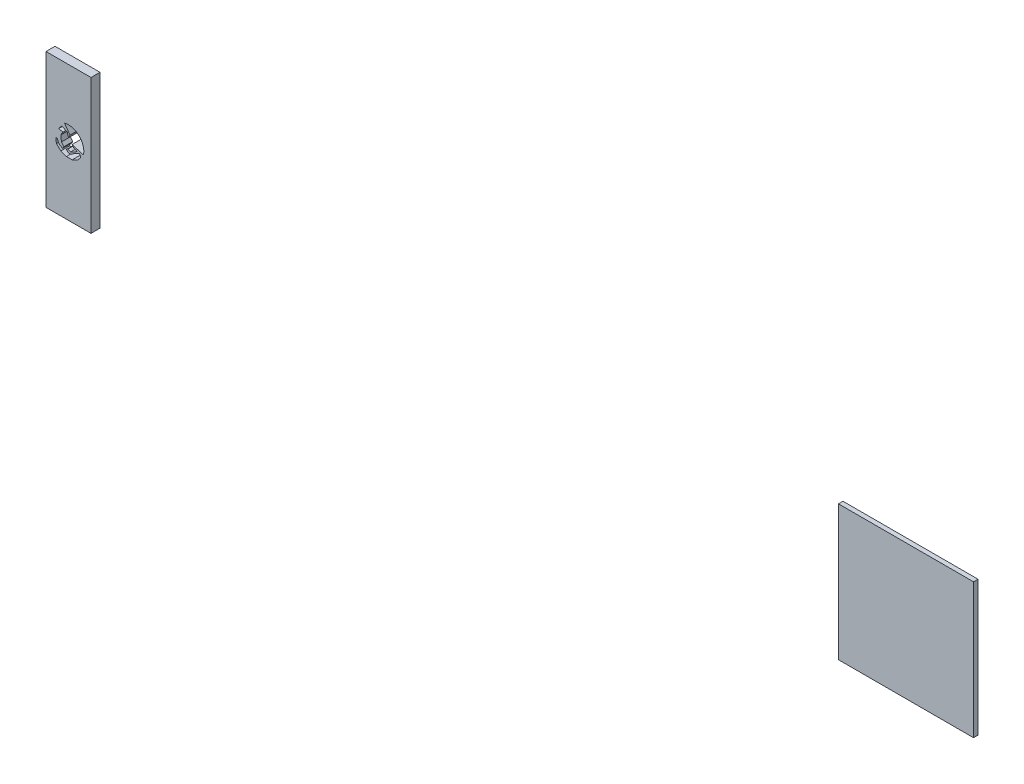
from build123d import *

# Parameters (mm, degrees)
CROQUIS1_W              = 15
CROQUIS1_H              = 15
SALIENTE_EXTRUIR1_DEPTH = 0.5
CROQUIS2_W              = 5
CROQUIS2_H              = 15
SALIENTE_EXTRUIR2_DEPTH = 1


with BuildPart() as part:
    # Croquis1 → Saliente-Extruir1 (new body)
    with BuildSketch(Plane.XY):
        with Locations((46.263983636, 17.815050794)):
            Rectangle(CROQUIS1_W, CROQUIS1_H)
    extrude(amount=SALIENTE_EXTRUIR1_DEPTH)


with BuildPart() as body_2:
    # Croquis2 → Saliente-Extruir2 (new body)
    with BuildSketch(Plane.XY):
        with Locations((-46.263983636, 17.815050794)):
            Rectangle(CROQUIS2_W, CROQUIS2_H)
        with BuildLine():
            Line((-46.702364849, 19.456400566), (-46.104716051, 18.600270795))
            Line((-46.104716051, 18.600270795), (-46.263983636, 18.262314678))
            Line((-46.263983636, 18.262314678), (-46.40354045, 18.74109689))
            Line((-46.40354045, 18.74109689), (-47.013043673, 19.02833568))
            Line((-47.013043673, 19.02833568), (-47.359981629, 18.600270795))
            Line((-47.359981629, 18.600270795), (-46.888792293, 18.501705784))
            Line((-46.888792293, 18.501705784), (-47.124386961, 18.101439004))
            Line((-47.124386961, 18.101439004), (-47.051735301, 17.465613962))
            Line((-47.051735301, 17.465613962), (-46.776783931, 17.144837365))
            Line((-46.776783931, 17.144837365), (-46.914259616, 16.911271172))
            Line((-46.914259616, 16.911271172), (-47.311080091, 17.144837365))
            Line((-47.311080091, 17.144837365), (-47.513983636, 17.562992572))
            Line((-47.513983636, 17.562992572), (-47.686595328, 17.599100082))
            Line((-47.686595328, 17.599100082), (-47.600289482, 17.028054268))
            Line((-47.600289482, 17.028054268), (-47.112669854, 16.574179388))
            Line((-47.112669854, 16.574179388), (-46.489318425, 16.344717423))
            Line((-46.489318425, 16.344717423), (-45.856721312, 16.344717423))
            Line((-45.856721312, 16.344717423), (-45.254925471, 16.636729832))
            Line((-45.254925471, 16.636729832), (-44.93019506, 16.985603341))
            Line((-44.93019506, 16.985603341), (-44.93019506, 17.199134303))
            Line((-44.93019506, 17.199134303), (-45.092560266, 17.350263347))
            Line((-45.092560266, 17.350263347), (-45.473269715, 17.165529795))
            Line((-45.473269715, 17.165529795), (-45.980893746, 16.811166586))
            Line((-45.980893746, 16.811166586), (-46.333762043, 16.811166586))
            Line((-46.333762043, 16.811166586), (-46.489318425, 17.034000549))
            Line((-46.489318425, 17.034000549), (-46.333762043, 17.142591662))
            Line((-46.333762043, 17.142591662), (-46.022912745, 17.028164892))
            Line((-46.022912745, 17.028164892), (-45.555823392, 17.254812997))
            Line((-45.555823392, 17.254812997), (-45.28291499, 17.445325445))
            Line((-45.28291499, 17.445325445), (-45.727081731, 17.608827713))
            Line((-45.727081731, 17.608827713), (-45.871042355, 17.815050794))
            Line((-45.871042355, 17.815050794), (-44.605818889, 17.445325445))
            ThreePointArc((-44.605818889, 17.445325445), (-45.087942075, 19.041074207), (-46.702364849, 19.456400566))
        make_face(mode=Mode.SUBTRACT)
    extrude(amount=SALIENTE_EXTRUIR2_DEPTH)


solid = Compound([part.part, body_2.part])
